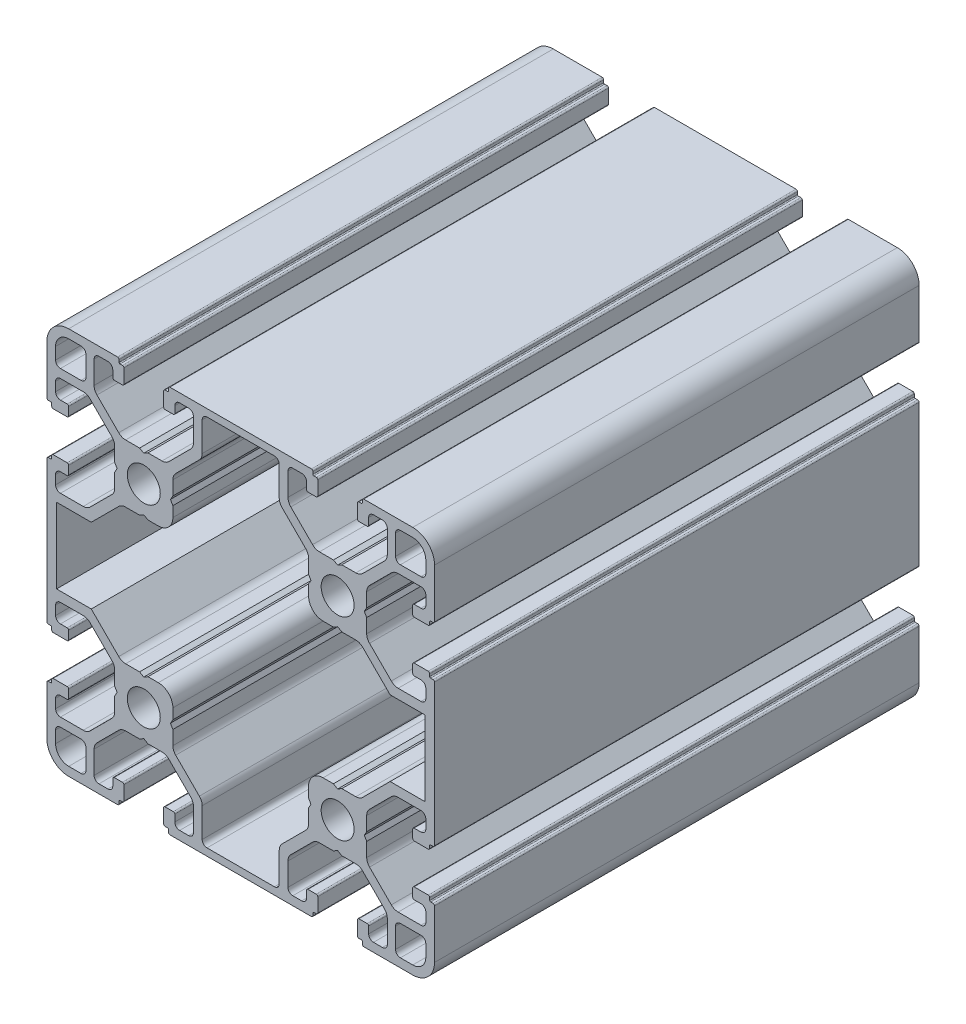
from build123d import *

# Parameters (mm, degrees)
SKETCH_1_R      = 3.4
EXTRUDE_1_DEPTH = 100


with BuildPart() as part:
    # 草图1 → 凸台-拉伸1 (new body)
    with BuildSketch(Plane.XY):
        with BuildLine():
            Line((-40.7856131, -14.145792426), (-40.7856131, 15.054207574))
            ThreePointArc((-40.7856131, 15.054207574), (-40.697745134, 15.266339608), (-40.4856131, 15.354207574))
            Line((-40.4856131, 15.354207574), (-39.9856131, 15.354207574))
            ThreePointArc((-39.9856131, 15.354207574), (-39.844191743, 15.412786217), (-39.7856131, 15.554207574))
            Line((-39.7856131, 15.554207574), (-39.7856131, 16.054207574))
            ThreePointArc((-39.7856131, 16.054207574), (-39.697745134, 16.266339608), (-39.4856131, 16.354207574))
            Line((-39.4856131, 16.354207574), (-36.5856131, 16.354207574))
            ThreePointArc((-36.5856131, 16.354207574), (-36.373481065, 16.266339608), (-36.2856131, 16.054207574))
            Line((-36.2856131, 16.054207574), (-36.2856131, 14.354207574))
            ThreePointArc((-36.2856131, 14.354207574), (-36.373481065, 14.142075539), (-36.5856131, 14.054207574))
            Line((-36.5856131, 14.054207574), (-37.9856131, 14.054207574))
            ThreePointArc((-37.9856131, 14.054207574), (-38.692719881, 13.761314355), (-38.9856131, 13.054207574))
            Line((-38.9856131, 13.054207574), (-38.9856131, 11.204207574))
            ThreePointArc((-38.9856131, 11.204207574), (-38.692719881, 10.497100792), (-37.9856131, 10.204207574))
            Line((-37.9856131, 10.204207574), (-33.278253787, 10.204207574))
            ThreePointArc((-33.278253787, 10.204207574), (-32.512886922, 10.356448509), (-31.864040224, 10.789994011))
            Line((-31.864040224, 10.789994011), (-27.371399537, 15.282634698))
            ThreePointArc((-27.371399537, 15.282634698), (-26.937854035, 15.931481396), (-26.7856131, 16.696848261))
            Line((-26.7856131, 16.696848261), (-26.7856131, 19.58818217))
            Line((-26.7856131, 19.58818217), (-26.2856131, 20.454207574))
            Line((-26.2856131, 20.454207574), (-26.7856131, 21.320232977))
            Line((-26.7856131, 21.320232977), (-26.7856131, 24.211566887))
            ThreePointArc((-26.7856131, 24.211566887), (-26.937854035, 24.976933751), (-27.371399537, 25.625780449))
            Line((-27.371399537, 25.625780449), (-31.864040224, 30.118421136))
            ThreePointArc((-31.864040224, 30.118421136), (-32.512886922, 30.551966639), (-33.278253787, 30.704207574))
            Line((-33.278253787, 30.704207574), (-37.9856131, 30.704207574))
            ThreePointArc((-37.9856131, 30.704207574), (-38.692719881, 30.411314355), (-38.9856131, 29.704207574))
            Line((-38.9856131, 29.704207574), (-38.9856131, 27.854207574))
            ThreePointArc((-38.9856131, 27.854207574), (-38.692719881, 27.147100792), (-37.9856131, 26.854207574))
            Line((-37.9856131, 26.854207574), (-36.5856131, 26.854207574))
            ThreePointArc((-36.5856131, 26.854207574), (-36.373481065, 26.766339608), (-36.2856131, 26.554207574))
            Line((-36.2856131, 26.554207574), (-36.2856131, 24.854207574))
            ThreePointArc((-36.2856131, 24.854207574), (-36.373481065, 24.642075539), (-36.5856131, 24.554207574))
            Line((-36.5856131, 24.554207574), (-39.4856131, 24.554207574))
            ThreePointArc((-39.4856131, 24.554207574), (-39.697745134, 24.642075539), (-39.7856131, 24.854207574))
            Line((-39.7856131, 24.854207574), (-39.7856131, 25.354207574))
            ThreePointArc((-39.7856131, 25.354207574), (-39.844191743, 25.49562893), (-39.9856131, 25.554207574))
            Line((-39.9856131, 25.554207574), (-40.4856131, 25.554207574))
            ThreePointArc((-40.4856131, 25.554207574), (-40.697745134, 25.642075539), (-40.7856131, 25.854207574))
            Line((-40.7856131, 25.854207574), (-40.7856131, 35.954207574))
            ThreePointArc((-40.7856131, 35.954207574), (-39.467593615, 39.136188089), (-36.2856131, 40.454207574))
            Line((-36.2856131, 40.454207574), (-26.1856131, 40.454207574))
            ThreePointArc((-26.1856131, 40.454207574), (-25.973481065, 40.366339608), (-25.8856131, 40.154207574))
            Line((-25.8856131, 40.154207574), (-25.8856131, 39.654207574))
            ThreePointArc((-25.8856131, 39.654207574), (-25.827034456, 39.512786217), (-25.6856131, 39.454207574))
            Line((-25.6856131, 39.454207574), (-25.1856131, 39.454207574))
            ThreePointArc((-25.1856131, 39.454207574), (-24.973481065, 39.366339608), (-24.8856131, 39.154207574))
            Line((-24.8856131, 39.154207574), (-24.8856131, 36.254207574))
            ThreePointArc((-24.8856131, 36.254207574), (-24.973481065, 36.042075539), (-25.1856131, 35.954207574))
            Line((-25.1856131, 35.954207574), (-26.8856131, 35.954207574))
            ThreePointArc((-26.8856131, 35.954207574), (-27.097745134, 36.042075539), (-27.1856131, 36.254207574))
            Line((-27.1856131, 36.254207574), (-27.1856131, 37.654207574))
            ThreePointArc((-27.1856131, 37.654207574), (-27.478506318, 38.361314355), (-28.1856131, 38.654207574))
            Line((-28.1856131, 38.654207574), (-30.0356131, 38.654207574))
            ThreePointArc((-30.0356131, 38.654207574), (-30.742719881, 38.361314355), (-31.0356131, 37.654207574))
            Line((-31.0356131, 37.654207574), (-31.0356131, 32.946848261))
            ThreePointArc((-31.0356131, 32.946848261), (-30.883372165, 32.181481396), (-30.449826662, 31.532634698))
            Line((-30.449826662, 31.532634698), (-25.957185975, 27.039994011))
            ThreePointArc((-25.957185975, 27.039994011), (-25.308339277, 26.606448509), (-24.542972412, 26.454207574))
            Line((-24.542972412, 26.454207574), (-21.651638503, 26.454207574))
            Line((-21.651638503, 26.454207574), (-20.7856131, 25.954207574))
            Line((-20.7856131, 25.954207574), (-19.919587696, 26.454207574))
            Line((-19.919587696, 26.454207574), (-17.028253787, 26.454207574))
            ThreePointArc((-17.028253787, 26.454207574), (-16.262886922, 26.606448509), (-15.614040224, 27.039994011))
            Line((-15.614040224, 27.039994011), (-11.121399537, 31.532634698))
            ThreePointArc((-11.121399537, 31.532634698), (-10.687854035, 32.181481396), (-10.5356131, 32.946848261))
            Line((-10.5356131, 32.946848261), (-10.5356131, 37.654207574))
            ThreePointArc((-10.5356131, 37.654207574), (-10.828506318, 38.361314355), (-11.5356131, 38.654207574))
            Line((-11.5356131, 38.654207574), (-13.3856131, 38.654207574))
            ThreePointArc((-13.3856131, 38.654207574), (-14.092719881, 38.361314355), (-14.3856131, 37.654207574))
            Line((-14.3856131, 37.654207574), (-14.3856131, 36.254207574))
            ThreePointArc((-14.3856131, 36.254207574), (-14.473481065, 36.042075539), (-14.6856131, 35.954207574))
            Line((-14.6856131, 35.954207574), (-16.3856131, 35.954207574))
            ThreePointArc((-16.3856131, 35.954207574), (-16.597745134, 36.042075539), (-16.6856131, 36.254207574))
            Line((-16.6856131, 36.254207574), (-16.6856131, 39.154207574))
            ThreePointArc((-16.6856131, 39.154207574), (-16.597745134, 39.366339608), (-16.3856131, 39.454207574))
            Line((-16.3856131, 39.454207574), (-15.8856131, 39.454207574))
            ThreePointArc((-15.8856131, 39.454207574), (-15.744191743, 39.512786217), (-15.6856131, 39.654207574))
            Line((-15.6856131, 39.654207574), (-15.6856131, 40.154207574))
            ThreePointArc((-15.6856131, 40.154207574), (-15.597745134, 40.366339608), (-15.3856131, 40.454207574))
            Line((-15.3856131, 40.454207574), (13.8143869, 40.454207574))
            ThreePointArc((13.8143869, 40.454207574), (14.026518935, 40.366339608), (14.1143869, 40.154207574))
            Line((14.1143869, 40.154207574), (14.1143869, 39.654207574))
            ThreePointArc((14.1143869, 39.654207574), (14.172965544, 39.512786217), (14.3143869, 39.454207574))
            Line((14.3143869, 39.454207574), (14.8143869, 39.454207574))
            ThreePointArc((14.8143869, 39.454207574), (15.026518935, 39.366339608), (15.1143869, 39.154207574))
            Line((15.1143869, 39.154207574), (15.1143869, 36.254207574))
            ThreePointArc((15.1143869, 36.254207574), (15.026518935, 36.042075539), (14.8143869, 35.954207574))
            Line((14.8143869, 35.954207574), (13.1143869, 35.954207574))
            ThreePointArc((13.1143869, 35.954207574), (12.902254866, 36.042075539), (12.8143869, 36.254207574))
            Line((12.8143869, 36.254207574), (12.8143869, 37.654207574))
            ThreePointArc((12.8143869, 37.654207574), (12.521493682, 38.361314355), (11.8143869, 38.654207574))
            Line((11.8143869, 38.654207574), (9.9643869, 38.654207574))
            ThreePointArc((9.9643869, 38.654207574), (9.257280119, 38.361314355), (8.9643869, 37.654207574))
            Line((8.9643869, 37.654207574), (8.9643869, 32.946848261))
            ThreePointArc((8.9643869, 32.946848261), (9.116627835, 32.181481396), (9.550173338, 31.532634698))
            Line((9.550173338, 31.532634698), (14.042814025, 27.039994011))
            ThreePointArc((14.042814025, 27.039994011), (14.691660723, 26.606448509), (15.457027588, 26.454207574))
            Line((15.457027588, 26.454207574), (18.348361497, 26.454207574))
            Line((18.348361497, 26.454207574), (19.2143869, 25.954207574))
            Line((19.2143869, 25.954207574), (20.080412304, 26.454207574))
            Line((20.080412304, 26.454207574), (22.971746213, 26.454207574))
            ThreePointArc((22.971746213, 26.454207574), (23.737113078, 26.606448509), (24.385959776, 27.039994011))
            Line((24.385959776, 27.039994011), (28.878600463, 31.532634698))
            ThreePointArc((28.878600463, 31.532634698), (29.312145965, 32.181481396), (29.4643869, 32.946848261))
            Line((29.4643869, 32.946848261), (29.4643869, 37.654207574))
            ThreePointArc((29.4643869, 37.654207574), (29.171493682, 38.361314355), (28.4643869, 38.654207574))
            Line((28.4643869, 38.654207574), (26.6143869, 38.654207574))
            ThreePointArc((26.6143869, 38.654207574), (25.907280119, 38.361314355), (25.6143869, 37.654207574))
            Line((25.6143869, 37.654207574), (25.6143869, 36.254207574))
            ThreePointArc((25.6143869, 36.254207574), (25.526518935, 36.042075539), (25.3143869, 35.954207574))
            Line((25.3143869, 35.954207574), (23.6143869, 35.954207574))
            ThreePointArc((23.6143869, 35.954207574), (23.402254866, 36.042075539), (23.3143869, 36.254207574))
            Line((23.3143869, 36.254207574), (23.3143869, 39.154207574))
            ThreePointArc((23.3143869, 39.154207574), (23.402254866, 39.366339608), (23.6143869, 39.454207574))
            Line((23.6143869, 39.454207574), (24.1143869, 39.454207574))
            ThreePointArc((24.1143869, 39.454207574), (24.255808257, 39.512786217), (24.3143869, 39.654207574))
            Line((24.3143869, 39.654207574), (24.3143869, 40.154207574))
            ThreePointArc((24.3143869, 40.154207574), (24.402254866, 40.366339608), (24.6143869, 40.454207574))
            Line((24.6143869, 40.454207574), (34.714386901, 40.454207574))
            ThreePointArc((34.714386901, 40.454207574), (37.896367416, 39.136188089), (39.2143869, 35.954207574))
            Line((39.2143869, 35.954207574), (39.2143869, 25.854207574))
            ThreePointArc((39.2143869, 25.854207574), (39.126518935, 25.642075539), (38.9143869, 25.554207574))
            Line((38.9143869, 25.554207574), (38.4143869, 25.554207574))
            ThreePointArc((38.4143869, 25.554207574), (38.272965544, 25.49562893), (38.2143869, 25.354207574))
            Line((38.2143869, 25.354207574), (38.2143869, 24.854207574))
            ThreePointArc((38.2143869, 24.854207574), (38.126518935, 24.642075539), (37.9143869, 24.554207574))
            Line((37.9143869, 24.554207574), (35.0143869, 24.554207574))
            ThreePointArc((35.0143869, 24.554207574), (34.802254866, 24.642075539), (34.7143869, 24.854207574))
            Line((34.7143869, 24.854207574), (34.7143869, 26.554207574))
            ThreePointArc((34.7143869, 26.554207574), (34.802254866, 26.766339608), (35.0143869, 26.854207574))
            Line((35.0143869, 26.854207574), (36.4143869, 26.854207574))
            ThreePointArc((36.4143869, 26.854207574), (37.121493682, 27.147100793), (37.4143869, 27.854207574))
            Line((37.4143869, 27.854207574), (37.4143869, 29.704207574))
            ThreePointArc((37.4143869, 29.704207574), (37.121493682, 30.411314355), (36.4143869, 30.704207574))
            Line((36.4143869, 30.704207574), (31.707027588, 30.704207574))
            ThreePointArc((31.707027588, 30.704207574), (30.941660723, 30.551966639), (30.292814025, 30.118421136))
            Line((30.292814025, 30.118421136), (25.800173338, 25.625780449))
            ThreePointArc((25.800173338, 25.625780449), (25.366627835, 24.976933751), (25.2143869, 24.211566887))
            Line((25.2143869, 24.211566887), (25.2143869, 21.320232978))
            Line((25.2143869, 21.320232978), (24.7143869, 20.454207574))
            Line((24.7143869, 20.454207574), (25.2143869, 19.58818217))
            Line((25.2143869, 19.58818217), (25.2143869, 16.696848261))
            ThreePointArc((25.2143869, 16.696848261), (25.366627835, 15.931481396), (25.800173338, 15.282634698))
            Line((25.800173338, 15.282634698), (30.292814025, 10.789994011))
            ThreePointArc((30.292814025, 10.789994011), (30.941660723, 10.356448509), (31.707027588, 10.204207574))
            Line((31.707027588, 10.204207574), (36.4143869, 10.204207574))
            ThreePointArc((36.4143869, 10.204207574), (37.121493682, 10.497100793), (37.4143869, 11.204207574))
            Line((37.4143869, 11.204207574), (37.4143869, 13.054207574))
            ThreePointArc((37.4143869, 13.054207574), (37.121493682, 13.761314355), (36.4143869, 14.054207574))
            Line((36.4143869, 14.054207574), (35.0143869, 14.054207574))
            ThreePointArc((35.0143869, 14.054207574), (34.802254866, 14.142075539), (34.7143869, 14.354207574))
            Line((34.7143869, 14.354207574), (34.7143869, 16.054207574))
            ThreePointArc((34.7143869, 16.054207574), (34.802254866, 16.266339608), (35.0143869, 16.354207574))
            Line((35.0143869, 16.354207574), (37.9143869, 16.354207574))
            ThreePointArc((37.9143869, 16.354207574), (38.126518935, 16.266339608), (38.2143869, 16.054207574))
            Line((38.2143869, 16.054207574), (38.2143869, 15.554207574))
            ThreePointArc((38.2143869, 15.554207574), (38.272965544, 15.412786217), (38.4143869, 15.354207574))
            Line((38.4143869, 15.354207574), (38.9143869, 15.354207574))
            ThreePointArc((38.9143869, 15.354207574), (39.126518935, 15.266339608), (39.2143869, 15.054207574))
            Line((39.2143869, 15.054207574), (39.2143869, -14.145792426))
            ThreePointArc((39.2143869, -14.145792426), (39.126518935, -14.357924461), (38.9143869, -14.445792426))
            Line((38.9143869, -14.445792426), (38.4143869, -14.445792426))
            ThreePointArc((38.4143869, -14.445792426), (38.272965544, -14.50437107), (38.2143869, -14.645792426))
            Line((38.2143869, -14.645792426), (38.2143869, -15.145792426))
            ThreePointArc((38.2143869, -15.145792426), (38.126518935, -15.357924461), (37.9143869, -15.445792426))
            Line((37.9143869, -15.445792426), (35.0143869, -15.445792426))
            ThreePointArc((35.0143869, -15.445792426), (34.802254866, -15.357924461), (34.7143869, -15.145792426))
            Line((34.7143869, -15.145792426), (34.7143869, -13.445792426))
            ThreePointArc((34.7143869, -13.445792426), (34.802254866, -13.233660392), (35.0143869, -13.145792426))
            Line((35.0143869, -13.145792426), (36.4143869, -13.145792426))
            ThreePointArc((36.4143869, -13.145792426), (37.121493682, -12.852899207), (37.4143869, -12.145792426))
            Line((37.4143869, -12.145792426), (37.4143869, -10.295792426))
            ThreePointArc((37.4143869, -10.295792426), (37.121493682, -9.588685645), (36.4143869, -9.295792426))
            Line((36.4143869, -9.295792426), (31.707027588, -9.295792426))
            ThreePointArc((31.707027588, -9.295792426), (30.941660723, -9.448033361), (30.292814025, -9.881578864))
            Line((30.292814025, -9.881578864), (25.800173338, -14.374219551))
            ThreePointArc((25.800173338, -14.374219551), (25.366627835, -15.023066249), (25.2143869, -15.788433113))
            Line((25.2143869, -15.788433113), (25.2143869, -18.679767023))
            Line((25.2143869, -18.679767023), (24.7143869, -19.545792426))
            Line((24.7143869, -19.545792426), (25.2143869, -20.41181783))
            Line((25.2143869, -20.41181783), (25.2143869, -23.303151739))
            ThreePointArc((25.2143869, -23.303151739), (25.366627835, -24.068518604), (25.800173338, -24.717365302))
            Line((25.800173338, -24.717365302), (30.292814025, -29.210005989))
            ThreePointArc((30.292814025, -29.210005989), (30.941660723, -29.643551491), (31.707027588, -29.795792426))
            Line((31.707027588, -29.795792426), (36.4143869, -29.795792426))
            ThreePointArc((36.4143869, -29.795792426), (37.121493682, -29.502899208), (37.4143869, -28.795792426))
            Line((37.4143869, -28.795792426), (37.4143869, -26.945792426))
            ThreePointArc((37.4143869, -26.945792426), (37.121493682, -26.238685645), (36.4143869, -25.945792426))
            Line((36.4143869, -25.945792426), (35.0143869, -25.945792426))
            ThreePointArc((35.0143869, -25.945792426), (34.802254866, -25.857924461), (34.7143869, -25.645792426))
            Line((34.7143869, -25.645792426), (34.7143869, -23.945792426))
            ThreePointArc((34.7143869, -23.945792426), (34.802254866, -23.733660392), (35.0143869, -23.645792426))
            Line((35.0143869, -23.645792426), (37.9143869, -23.645792426))
            ThreePointArc((37.9143869, -23.645792426), (38.126518935, -23.733660392), (38.2143869, -23.945792426))
            Line((38.2143869, -23.945792426), (38.2143869, -24.445792426))
            ThreePointArc((38.2143869, -24.445792426), (38.272965544, -24.587213783), (38.4143869, -24.645792426))
            Line((38.4143869, -24.645792426), (38.9143869, -24.645792426))
            ThreePointArc((38.9143869, -24.645792426), (39.126518935, -24.733660392), (39.2143869, -24.945792426))
            Line((39.2143869, -24.945792426), (39.2143869, -35.045792426))
            ThreePointArc((39.2143869, -35.045792426), (37.896367416, -38.227772942), (34.714386901, -39.545792426))
            Line((34.714386901, -39.545792426), (24.6143869, -39.545792426))
            ThreePointArc((24.6143869, -39.545792426), (24.402254866, -39.457924461), (24.3143869, -39.245792426))
            Line((24.3143869, -39.245792426), (24.3143869, -38.745792426))
            ThreePointArc((24.3143869, -38.745792426), (24.255808257, -38.60437107), (24.1143869, -38.545792426))
            Line((24.1143869, -38.545792426), (23.6143869, -38.545792426))
            ThreePointArc((23.6143869, -38.545792426), (23.402254866, -38.457924461), (23.3143869, -38.245792426))
            Line((23.3143869, -38.245792426), (23.3143869, -35.345792426))
            ThreePointArc((23.3143869, -35.345792426), (23.402254866, -35.133660392), (23.6143869, -35.045792426))
            Line((23.6143869, -35.045792426), (25.3143869, -35.045792426))
            ThreePointArc((25.3143869, -35.045792426), (25.526518935, -35.133660392), (25.6143869, -35.345792426))
            Line((25.6143869, -35.345792426), (25.6143869, -36.745792426))
            ThreePointArc((25.6143869, -36.745792426), (25.907280119, -37.452899208), (26.6143869, -37.745792426))
            Line((26.6143869, -37.745792426), (28.4643869, -37.745792426))
            ThreePointArc((28.4643869, -37.745792426), (29.171493682, -37.452899208), (29.4643869, -36.745792426))
            Line((29.4643869, -36.745792426), (29.4643869, -32.038433113))
            ThreePointArc((29.4643869, -32.038433113), (29.312145965, -31.273066249), (28.878600463, -30.624219551))
            Line((28.878600463, -30.624219551), (24.385959776, -26.131578864))
            ThreePointArc((24.385959776, -26.131578864), (23.737113078, -25.698033361), (22.971746213, -25.545792426))
            Line((22.971746213, -25.545792426), (20.080412304, -25.545792426))
            Line((20.080412304, -25.545792426), (19.2143869, -25.045792426))
            Line((19.2143869, -25.045792426), (18.348361497, -25.545792426))
            Line((18.348361497, -25.545792426), (15.457027588, -25.545792426))
            ThreePointArc((15.457027588, -25.545792426), (14.691660723, -25.698033361), (14.042814025, -26.131578864))
            Line((14.042814025, -26.131578864), (9.550173338, -30.624219551))
            ThreePointArc((9.550173338, -30.624219551), (9.116627835, -31.273066249), (8.9643869, -32.038433114))
            Line((8.9643869, -32.038433114), (8.9643869, -36.745792426))
            ThreePointArc((8.9643869, -36.745792426), (9.257280119, -37.452899208), (9.9643869, -37.745792426))
            Line((9.9643869, -37.745792426), (11.8143869, -37.745792426))
            ThreePointArc((11.8143869, -37.745792426), (12.521493682, -37.452899208), (12.8143869, -36.745792426))
            Line((12.8143869, -36.745792426), (12.8143869, -35.345792426))
            ThreePointArc((12.8143869, -35.345792426), (12.902254866, -35.133660392), (13.1143869, -35.045792426))
            Line((13.1143869, -35.045792426), (14.8143869, -35.045792426))
            ThreePointArc((14.8143869, -35.045792426), (15.026518935, -35.133660392), (15.1143869, -35.345792426))
            Line((15.1143869, -35.345792426), (15.1143869, -38.245792426))
            ThreePointArc((15.1143869, -38.245792426), (15.026518935, -38.457924461), (14.8143869, -38.545792426))
            Line((14.8143869, -38.545792426), (14.3143869, -38.545792426))
            ThreePointArc((14.3143869, -38.545792426), (14.172965544, -38.60437107), (14.1143869, -38.745792426))
            Line((14.1143869, -38.745792426), (14.1143869, -39.245792426))
            ThreePointArc((14.1143869, -39.245792426), (14.026518935, -39.457924461), (13.8143869, -39.545792426))
            Line((13.8143869, -39.545792426), (-15.3856131, -39.545792426))
            ThreePointArc((-15.3856131, -39.545792426), (-15.597745134, -39.457924461), (-15.6856131, -39.245792426))
            Line((-15.6856131, -39.245792426), (-15.6856131, -38.745792426))
            ThreePointArc((-15.6856131, -38.745792426), (-15.744191743, -38.60437107), (-15.8856131, -38.545792426))
            Line((-15.8856131, -38.545792426), (-16.3856131, -38.545792426))
            ThreePointArc((-16.3856131, -38.545792426), (-16.597745134, -38.457924461), (-16.6856131, -38.245792426))
            Line((-16.6856131, -38.245792426), (-16.6856131, -35.345792426))
            ThreePointArc((-16.6856131, -35.345792426), (-16.597745134, -35.133660392), (-16.3856131, -35.045792426))
            Line((-16.3856131, -35.045792426), (-14.6856131, -35.045792426))
            ThreePointArc((-14.6856131, -35.045792426), (-14.473481065, -35.133660392), (-14.3856131, -35.345792426))
            Line((-14.3856131, -35.345792426), (-14.3856131, -36.745792426))
            ThreePointArc((-14.3856131, -36.745792426), (-14.092719881, -37.452899208), (-13.3856131, -37.745792426))
            Line((-13.3856131, -37.745792426), (-11.5356131, -37.745792426))
            ThreePointArc((-11.5356131, -37.745792426), (-10.828506318, -37.452899208), (-10.5356131, -36.745792426))
            Line((-10.5356131, -36.745792426), (-10.5356131, -32.038433114))
            ThreePointArc((-10.5356131, -32.038433114), (-10.687854035, -31.273066249), (-11.121399537, -30.624219551))
            Line((-11.121399537, -30.624219551), (-15.614040224, -26.131578864))
            ThreePointArc((-15.614040224, -26.131578864), (-16.262886922, -25.698033361), (-17.028253787, -25.545792426))
            Line((-17.028253787, -25.545792426), (-19.919587696, -25.545792426))
            Line((-19.919587696, -25.545792426), (-20.7856131, -25.045792426))
            Line((-20.7856131, -25.045792426), (-21.651638503, -25.545792426))
            Line((-21.651638503, -25.545792426), (-24.542972413, -25.545792426))
            ThreePointArc((-24.542972413, -25.545792426), (-25.308339277, -25.698033361), (-25.957185975, -26.131578864))
            Line((-25.957185975, -26.131578864), (-30.449826662, -30.624219551))
            ThreePointArc((-30.449826662, -30.624219551), (-30.883372165, -31.273066249), (-31.0356131, -32.038433113))
            Line((-31.0356131, -32.038433113), (-31.0356131, -36.745792426))
            ThreePointArc((-31.0356131, -36.745792426), (-30.742719881, -37.452899208), (-30.0356131, -37.745792426))
            Line((-30.0356131, -37.745792426), (-28.1856131, -37.745792426))
            ThreePointArc((-28.1856131, -37.745792426), (-27.478506318, -37.452899208), (-27.1856131, -36.745792426))
            Line((-27.1856131, -36.745792426), (-27.1856131, -35.345792426))
            ThreePointArc((-27.1856131, -35.345792426), (-27.097745134, -35.133660392), (-26.8856131, -35.045792426))
            Line((-26.8856131, -35.045792426), (-25.1856131, -35.045792426))
            ThreePointArc((-25.1856131, -35.045792426), (-24.973481065, -35.133660392), (-24.8856131, -35.345792426))
            Line((-24.8856131, -35.345792426), (-24.8856131, -38.245792426))
            ThreePointArc((-24.8856131, -38.245792426), (-24.973481065, -38.457924461), (-25.1856131, -38.545792426))
            Line((-25.1856131, -38.545792426), (-25.6856131, -38.545792426))
            ThreePointArc((-25.6856131, -38.545792426), (-25.827034456, -38.60437107), (-25.8856131, -38.745792426))
            Line((-25.8856131, -38.745792426), (-25.8856131, -39.245792426))
            ThreePointArc((-25.8856131, -39.245792426), (-25.973481065, -39.457924461), (-26.1856131, -39.545792426))
            Line((-26.1856131, -39.545792426), (-36.2856131, -39.545792426))
            ThreePointArc((-36.2856131, -39.545792426), (-39.467593615, -38.227772942), (-40.7856131, -35.045792426))
            Line((-40.7856131, -35.045792426), (-40.7856131, -24.945792426))
            ThreePointArc((-40.7856131, -24.945792426), (-40.697745134, -24.733660392), (-40.4856131, -24.645792426))
            Line((-40.4856131, -24.645792426), (-39.9856131, -24.645792426))
            ThreePointArc((-39.9856131, -24.645792426), (-39.844191743, -24.587213783), (-39.7856131, -24.445792426))
            Line((-39.7856131, -24.445792426), (-39.7856131, -23.945792426))
            ThreePointArc((-39.7856131, -23.945792426), (-39.697745134, -23.733660392), (-39.4856131, -23.645792426))
            Line((-39.4856131, -23.645792426), (-36.5856131, -23.645792426))
            ThreePointArc((-36.5856131, -23.645792426), (-36.373481065, -23.733660392), (-36.2856131, -23.945792426))
            Line((-36.2856131, -23.945792426), (-36.2856131, -25.645792426))
            ThreePointArc((-36.2856131, -25.645792426), (-36.373481065, -25.857924461), (-36.5856131, -25.945792426))
            Line((-36.5856131, -25.945792426), (-37.9856131, -25.945792426))
            ThreePointArc((-37.9856131, -25.945792426), (-38.692719881, -26.238685645), (-38.9856131, -26.945792426))
            Line((-38.9856131, -26.945792426), (-38.9856131, -28.795792426))
            ThreePointArc((-38.9856131, -28.795792426), (-38.692719881, -29.502899208), (-37.9856131, -29.795792426))
            Line((-37.9856131, -29.795792426), (-33.278253787, -29.795792426))
            ThreePointArc((-33.278253787, -29.795792426), (-32.512886922, -29.643551491), (-31.864040224, -29.210005989))
            Line((-31.864040224, -29.210005989), (-27.371399537, -24.717365302))
            ThreePointArc((-27.371399537, -24.717365302), (-26.937854035, -24.068518604), (-26.7856131, -23.303151739))
            Line((-26.7856131, -23.303151739), (-26.7856131, -20.41181783))
            Line((-26.7856131, -20.41181783), (-26.2856131, -19.545792426))
            Line((-26.2856131, -19.545792426), (-26.7856131, -18.679767023))
            Line((-26.7856131, -18.679767023), (-26.7856131, -15.788433113))
            ThreePointArc((-26.7856131, -15.788433113), (-26.937854035, -15.023066249), (-27.371399537, -14.374219551))
            Line((-27.371399537, -14.374219551), (-31.864040224, -9.881578864))
            ThreePointArc((-31.864040224, -9.881578864), (-32.512886922, -9.448033361), (-33.278253787, -9.295792426))
            Line((-33.278253787, -9.295792426), (-37.9856131, -9.295792426))
            ThreePointArc((-37.9856131, -9.295792426), (-38.692719881, -9.588685645), (-38.9856131, -10.295792426))
            Line((-38.9856131, -10.295792426), (-38.9856131, -12.145792426))
            ThreePointArc((-38.9856131, -12.145792426), (-38.692719881, -12.852899208), (-37.9856131, -13.145792426))
            Line((-37.9856131, -13.145792426), (-36.5856131, -13.145792426))
            ThreePointArc((-36.5856131, -13.145792426), (-36.373481065, -13.233660392), (-36.2856131, -13.445792426))
            Line((-36.2856131, -13.445792426), (-36.2856131, -15.145792426))
            ThreePointArc((-36.2856131, -15.145792426), (-36.373481065, -15.357924461), (-36.5856131, -15.445792426))
            Line((-36.5856131, -15.445792426), (-39.4856131, -15.445792426))
            ThreePointArc((-39.4856131, -15.445792426), (-39.697745134, -15.357924461), (-39.7856131, -15.145792426))
            Line((-39.7856131, -15.145792426), (-39.7856131, -14.645792426))
            ThreePointArc((-39.7856131, -14.645792426), (-39.844191743, -14.50437107), (-39.9856131, -14.445792426))
            Line((-39.9856131, -14.445792426), (-40.4856131, -14.445792426))
            ThreePointArc((-40.4856131, -14.445792426), (-40.697745134, -14.357924461), (-40.7856131, -14.145792426))
        make_face()
        with Locations((19.2143869, -19.545792426)):
            Circle(SKETCH_1_R, mode=Mode.SUBTRACT)
        with Locations((-20.7856131, -19.545792426)):
            Circle(SKETCH_1_R, mode=Mode.SUBTRACT)
        with Locations((-20.7856131, 20.454207574)):
            Circle(SKETCH_1_R, mode=Mode.SUBTRACT)
        with Locations((19.2143869, 20.454207574)):
            Circle(SKETCH_1_R, mode=Mode.SUBTRACT)
        with BuildLine():
            Line((-19.919587696, 14.454207574), (-17.7856131, 14.454207574))
            ThreePointArc((-17.7856131, 14.454207574), (-15.664292756, 15.33288723), (-14.7856131, 17.454207574))
            Line((-14.7856131, 17.454207574), (-14.7856131, 19.58818217))
            Line((-14.7856131, 19.58818217), (-15.2856131, 20.454207574))
            Line((-15.2856131, 20.454207574), (-14.7856131, 21.320232977))
            Line((-14.7856131, 21.320232977), (-14.7856131, 24.211566887))
            ThreePointArc((-14.7856131, 24.211566887), (-14.633372165, 24.976933751), (-14.199826662, 25.625780449))
            Line((-14.199826662, 25.625780449), (-9.321399537, 30.504207574))
            ThreePointArc((-9.321399537, 30.504207574), (-8.887854035, 31.153054271), (-8.7356131, 31.918421136))
            Line((-8.7356131, 31.918421136), (-8.7356131, 37.954207574))
            ThreePointArc((-8.7356131, 37.954207574), (-8.442719881, 38.661314355), (-7.7356131, 38.954207574))
            Line((-7.7356131, 38.954207574), (6.1643869, 38.954207574))
            ThreePointArc((6.1643869, 38.954207574), (6.871493682, 38.661314355), (7.1643869, 37.954207574))
            Line((7.1643869, 37.954207574), (7.1643869, 31.918421136))
            ThreePointArc((7.1643869, 31.918421136), (7.316627835, 31.153054271), (7.750173338, 30.504207574))
            Line((7.750173338, 30.504207574), (12.628600463, 25.625780449))
            ThreePointArc((12.628600463, 25.625780449), (13.062145965, 24.976933751), (13.2143869, 24.211566887))
            Line((13.2143869, 24.211566887), (13.2143869, 21.320232977))
            Line((13.2143869, 21.320232977), (13.7143869, 20.454207574))
            Line((13.7143869, 20.454207574), (13.2143869, 19.58818217))
            Line((13.2143869, 19.58818217), (13.2143869, 17.454207574))
            ThreePointArc((13.2143869, 17.454207574), (14.093066557, 15.33288723), (16.2143869, 14.454207574))
            Line((16.2143869, 14.454207574), (18.348361497, 14.454207574))
            Line((18.348361497, 14.454207574), (19.2143869, 14.954207574))
            Line((19.2143869, 14.954207574), (20.080412304, 14.454207574))
            Line((20.080412304, 14.454207574), (22.971746213, 14.454207574))
            ThreePointArc((22.971746213, 14.454207574), (23.737113078, 14.301966639), (24.385959776, 13.868421136))
            Line((24.385959776, 13.868421136), (30.050173338, 8.204207574))
            Line((30.050173338, 8.204207574), (37.2143869, 8.204207574))
            Line((37.2143869, 8.204207574), (37.2143869, -7.295792426))
            Line((37.2143869, -7.295792426), (30.050173338, -7.295792426))
            Line((30.050173338, -7.295792426), (24.385959776, -12.960005989))
            ThreePointArc((24.385959776, -12.960005989), (23.737113078, -13.393551491), (22.971746213, -13.545792426))
            Line((22.971746213, -13.545792426), (20.080412304, -13.545792426))
            Line((20.080412304, -13.545792426), (19.2143869, -14.045792426))
            Line((19.2143869, -14.045792426), (18.348361497, -13.545792426))
            Line((18.348361497, -13.545792426), (16.2143869, -13.545792426))
            ThreePointArc((16.2143869, -13.545792426), (14.093066557, -14.424472083), (13.2143869, -16.545792426))
            Line((13.2143869, -16.545792426), (13.2143869, -18.679767023))
            Line((13.2143869, -18.679767023), (13.7143869, -19.545792426))
            Line((13.7143869, -19.545792426), (13.2143869, -20.41181783))
            Line((13.2143869, -20.41181783), (13.2143869, -23.303151739))
            ThreePointArc((13.2143869, -23.303151739), (13.062145965, -24.068518604), (12.628600463, -24.717365302))
            Line((12.628600463, -24.717365302), (7.750173338, -29.595792426))
            ThreePointArc((7.750173338, -29.595792426), (7.316627835, -30.244639124), (7.1643869, -31.010005989))
            Line((7.1643869, -31.010005989), (7.1643869, -37.045792426))
            ThreePointArc((7.1643869, -37.045792426), (6.871493682, -37.752899208), (6.1643869, -38.045792426))
            Line((6.1643869, -38.045792426), (-7.7356131, -38.045792426))
            ThreePointArc((-7.7356131, -38.045792426), (-8.442719881, -37.752899208), (-8.7356131, -37.045792426))
            Line((-8.7356131, -37.045792426), (-8.7356131, -31.010005989))
            ThreePointArc((-8.7356131, -31.010005989), (-8.887854035, -30.244639124), (-9.321399537, -29.595792426))
            Line((-9.321399537, -29.595792426), (-14.199826662, -24.717365302))
            ThreePointArc((-14.199826662, -24.717365302), (-14.633372165, -24.068518604), (-14.7856131, -23.303151739))
            Line((-14.7856131, -23.303151739), (-14.7856131, -20.41181783))
            Line((-14.7856131, -20.41181783), (-15.2856131, -19.545792426))
            Line((-15.2856131, -19.545792426), (-14.7856131, -18.679767023))
            Line((-14.7856131, -18.679767023), (-14.7856131, -16.545792426))
            ThreePointArc((-14.7856131, -16.545792426), (-15.664292756, -14.424472083), (-17.7856131, -13.545792426))
            Line((-17.7856131, -13.545792426), (-19.919587696, -13.545792426))
            Line((-19.919587696, -13.545792426), (-20.7856131, -14.045792426))
            Line((-20.7856131, -14.045792426), (-21.651638503, -13.545792426))
            Line((-21.651638503, -13.545792426), (-24.542972413, -13.545792426))
            ThreePointArc((-24.542972413, -13.545792426), (-25.308339277, -13.393551491), (-25.957185975, -12.960005989))
            Line((-25.957185975, -12.960005989), (-31.621399537, -7.295792426))
            Line((-31.621399537, -7.295792426), (-38.7856131, -7.295792426))
            Line((-38.7856131, -7.295792426), (-38.7856131, 8.204207574))
            Line((-38.7856131, 8.204207574), (-31.621399537, 8.204207574))
            Line((-31.621399537, 8.204207574), (-25.957185975, 13.868421136))
            ThreePointArc((-25.957185975, 13.868421136), (-25.308339277, 14.301966639), (-24.542972413, 14.454207574))
            Line((-24.542972413, 14.454207574), (-21.651638503, 14.454207574))
            Line((-21.651638503, 14.454207574), (-20.7856131, 14.954207574))
            Line((-20.7856131, 14.954207574), (-19.919587696, 14.454207574))
        make_face(mode=Mode.SUBTRACT)
        with BuildLine():
            Line((-33.7356131, 38.654207574), (-36.2856131, 38.654207574))
            ThreePointArc((-36.2856131, 38.654207574), (-38.194801409, 37.863395883), (-38.9856131, 35.954207574))
            Line((-38.9856131, 35.954207574), (-38.9856131, 33.504207574))
            ThreePointArc((-38.9856131, 33.504207574), (-38.692719881, 32.797100792), (-37.9856131, 32.504207574))
            Line((-37.9856131, 32.504207574), (-33.7356131, 32.504207574))
            ThreePointArc((-33.7356131, 32.504207574), (-33.028506318, 32.797100792), (-32.7356131, 33.504207574))
            Line((-32.7356131, 33.504207574), (-32.7356131, 37.654207574))
            ThreePointArc((-32.7356131, 37.654207574), (-33.028506318, 38.361314355), (-33.7356131, 38.654207574))
        make_face(mode=Mode.SUBTRACT)
        with BuildLine():
            Line((32.1643869, 38.654207574), (34.714386901, 38.654207574))
            ThreePointArc((34.714386901, 38.654207574), (36.62357521, 37.863395883), (37.4143869, 35.954207574))
            Line((37.4143869, 35.954207574), (37.4143869, 33.504207574))
            ThreePointArc((37.4143869, 33.504207574), (37.121493682, 32.797100792), (36.4143869, 32.504207574))
            Line((36.4143869, 32.504207574), (32.1643869, 32.504207574))
            ThreePointArc((32.1643869, 32.504207574), (31.457280119, 32.797100792), (31.1643869, 33.504207574))
            Line((31.1643869, 33.504207574), (31.1643869, 37.654207574))
            ThreePointArc((31.1643869, 37.654207574), (31.457280119, 38.361314355), (32.1643869, 38.654207574))
        make_face(mode=Mode.SUBTRACT)
        with BuildLine():
            Line((-38.9856131, -35.045792426), (-38.9856131, -32.595792426))
            ThreePointArc((-38.9856131, -32.595792426), (-38.692719881, -31.888685645), (-37.9856131, -31.595792426))
            Line((-37.9856131, -31.595792426), (-33.7356131, -31.595792426))
            ThreePointArc((-33.7356131, -31.595792426), (-33.028506318, -31.888685645), (-32.7356131, -32.595792426))
            Line((-32.7356131, -32.595792426), (-32.7356131, -36.745792426))
            ThreePointArc((-32.7356131, -36.745792426), (-33.028506318, -37.452899208), (-33.7356131, -37.745792426))
            Line((-33.7356131, -37.745792426), (-36.2856131, -37.745792426))
            ThreePointArc((-36.2856131, -37.745792426), (-38.194801409, -36.954980736), (-38.9856131, -35.045792426))
        make_face(mode=Mode.SUBTRACT)
        with BuildLine():
            Line((37.4143869, -35.045792426), (37.4143869, -32.595792426))
            ThreePointArc((37.4143869, -32.595792426), (37.121493682, -31.888685645), (36.4143869, -31.595792426))
            Line((36.4143869, -31.595792426), (32.1643869, -31.595792426))
            ThreePointArc((32.1643869, -31.595792426), (31.457280119, -31.888685645), (31.1643869, -32.595792426))
            Line((31.1643869, -32.595792426), (31.1643869, -36.745792426))
            ThreePointArc((31.1643869, -36.745792426), (31.457280119, -37.452899208), (32.1643869, -37.745792426))
            Line((32.1643869, -37.745792426), (34.714386901, -37.745792426))
            ThreePointArc((34.714386901, -37.745792426), (36.62357521, -36.954980736), (37.4143869, -35.045792426))
        make_face(mode=Mode.SUBTRACT)
    extrude(amount=EXTRUDE_1_DEPTH)


solid = part.part
